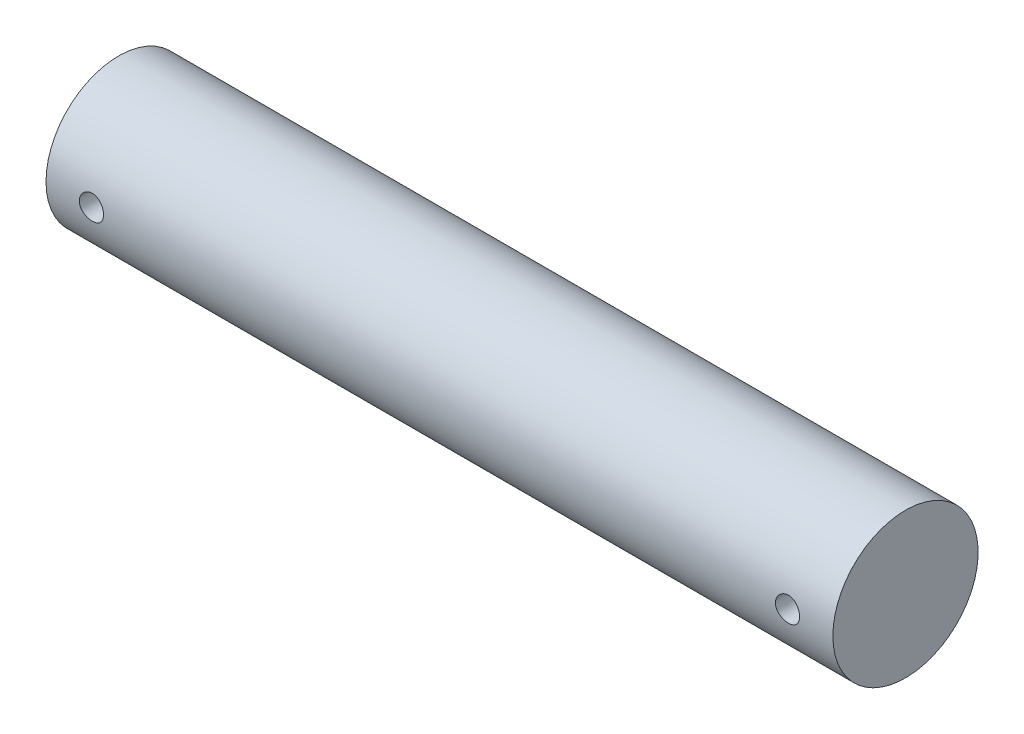
from build123d import *

# Parameters (mm, degrees)
SKETCH1_W               = 130
SKETCH1_H               = 12
CUT_EXTRUDE4_DEPTH      = 12
CUT_EXTRUDE4_DEPTH_BACK = 12
SKETCH2_R               = 2


with BuildPart() as part:
    # Sketch1 → Revolve1 (revolve)
    with BuildSketch(Plane(origin=(0, 0, 0), x_dir=(1, 0, 0), z_dir=(0, 1, 0))):
        with Locations((65, 6)):
            Rectangle(SKETCH1_W, SKETCH1_H)
    revolve(axis=Axis((0, 0, 0), (1, 0, 0)))

    # Sketch2 → Cut-Extrude4 (cut, two sides: drawn at the far end of the back side and taken through both)
    with BuildSketch(Plane.XY.offset(-CUT_EXTRUDE4_DEPTH_BACK)):
        with Locations((7.5, 0)):
            Circle(SKETCH2_R)
        with Locations((122.5, 0)):
            Circle(SKETCH2_R)
    extrude(amount=CUT_EXTRUDE4_DEPTH + CUT_EXTRUDE4_DEPTH_BACK, mode=Mode.SUBTRACT)


solid = part.part
